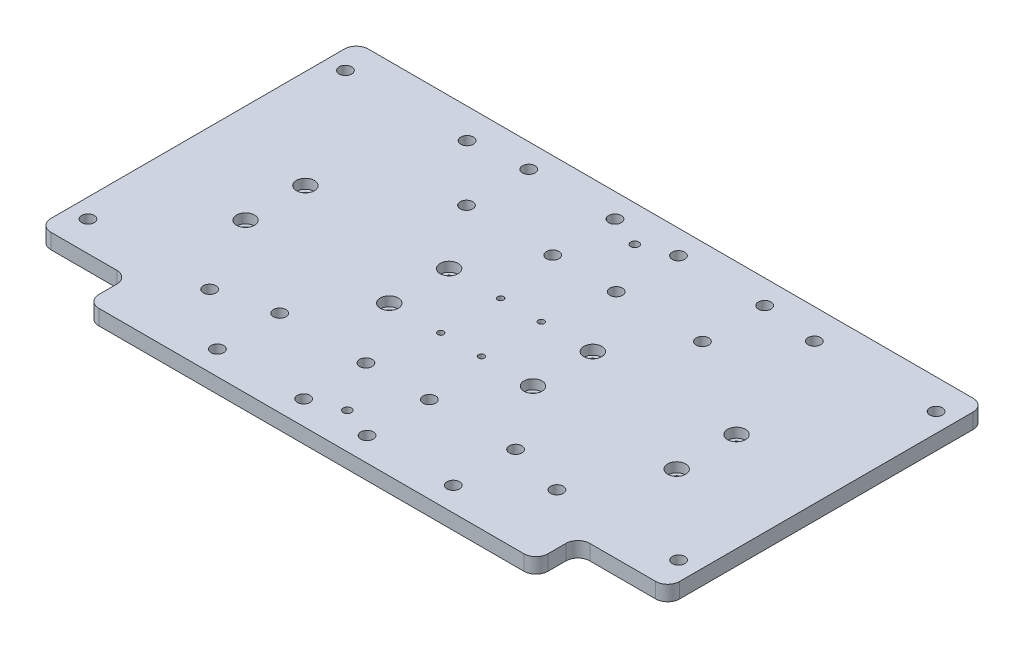
from build123d import *

# Parameters (mm, degrees)
BOSS_EXTRUDE1_DEPTH            = 6.35
M10_CLEARANCE_HOLE1_D          = 10.5
CBORE_FOR_M8_SHCS1_D           = 9
CBORE_FOR_M8_SHCS1_CBORE_D     = 15
CBORE_FOR_M8_SHCS1_CBORE_DEPTH = 8
LPATTERN1_COUNT                = 2
LPATTERN1_PITCH                = 120
LPATTERN1_COL_COUNT            = 3
LPATTERN1_COL_PITCH            = 120
M6X1_0_TAPPED_HOLE1_D          = 5
M8X1_25_TAPPED_HOLE1_D         = 6.8


with BuildPart() as part:
    # Sketch1 → Boss-Extrude1 (new, symmetric)
    with BuildSketch(Plane(origin=(0, 0, 0), x_dir=(1, 0, 0), z_dir=(0, 1, 0))):
        with BuildLine():
            Line((-252.5, -115), (-197.5, -115))
            ThreePointArc((-197.5, -115), (-190.428932188, -117.928932188), (-187.5, -125))
            Line((-187.5, -125), (-187.5, -140))
            ThreePointArc((-187.5, -140), (-184.571067812, -147.071067812), (-177.5, -150))
            Line((-177.5, -150), (177.5, -150))
            ThreePointArc((177.5, -150), (184.571067812, -147.071067812), (187.5, -140))
            Line((187.5, -140), (187.5, -125))
            ThreePointArc((187.5, -125), (190.428932188, -117.928932188), (197.5, -115))
            Line((197.5, -115), (252.5, -115))
            ThreePointArc((252.5, -115), (259.571067812, -112.071067812), (262.5, -105))
            Line((262.5, -105), (262.5, 140))
            ThreePointArc((262.5, 140), (259.571067812, 147.071067812), (252.5, 150))
            Line((252.5, 150), (-252.5, 150))
            ThreePointArc((-252.5, 150), (-259.571067812, 147.071067812), (-262.5, 140))
            Line((-262.5, 140), (-262.5, -105))
            ThreePointArc((-262.5, -105), (-259.571067812, -112.071067812), (-252.5, -115))
        make_face()
    extrude(amount=BOSS_EXTRUDE1_DEPTH, both=True)

    # M10 Clearance Hole1 (through all)
    with Locations(Plane(origin=(0, 6.35, 0), x_dir=(1, 0, 0), z_dir=(0, 1, 0))):
        with Locations((-98.5, -130), (-26.5, -130), (-26.5, -78), (-98.5, -78), (98.5, -78), (26.5, -78), (26.5, -130), (98.5, -130), (98.5, 130), (26.5, 130), (26.5, 78), (98.5, 78), (-98.5, 78), (-26.5, 78), (-26.5, 130), (-98.5, 130), (-246.6, 125), (-145, 125), (-145, -90), (-246.6, -90), (145, -90), (246.6, -90), (145, 125), (246.6, 125)):
            Hole(M10_CLEARANCE_HOLE1_D / 2)

    # CBORE for M8 SHCS1 (through all)
    with Locations(Plane(origin=(0, 6.35, 0), x_dir=(1, 0, 0), z_dir=(0, 1, 0))):
        with Locations((60, 25), (60, -25)):
            cbore_for_m8_shcs1 = CounterBoreHole(CBORE_FOR_M8_SHCS1_D / 2, CBORE_FOR_M8_SHCS1_CBORE_D / 2, CBORE_FOR_M8_SHCS1_CBORE_DEPTH)

    # LPattern1: CBORE for M8 SHCS1 ×2
    with Locations(*[(i * LPATTERN1_PITCH, 0, 0) for i in range(1, LPATTERN1_COUNT)]):
        add(cbore_for_m8_shcs1, mode=Mode.SUBTRACT)

    # LPattern1 col: CBORE for M8 SHCS1 ×3
    with Locations(*[(-i * LPATTERN1_COL_PITCH, 0, 0) for i in range(1, LPATTERN1_COL_COUNT)]):
        add(cbore_for_m8_shcs1, mode=Mode.SUBTRACT)

    # M6x1.0 Tapped Hole1 (through all)
    with Locations(Plane(origin=(0, 6.35, 0), x_dir=(1, 0, 0), z_dir=(0, 1, 0))):
        with Locations((17, 25), (17, -25), (-17, -25), (-17, 25)):
            Hole(M6X1_0_TAPPED_HOLE1_D / 2)

    # M8x1.25 Tapped Hole1 (through all)
    with Locations(Plane(origin=(0, 6.35, 0), x_dir=(1, 0, 0), z_dir=(0, 1, 0))):
        with Locations((0, -120), (0, 120)):
            Hole(M8X1_25_TAPPED_HOLE1_D / 2)


solid = part.part
